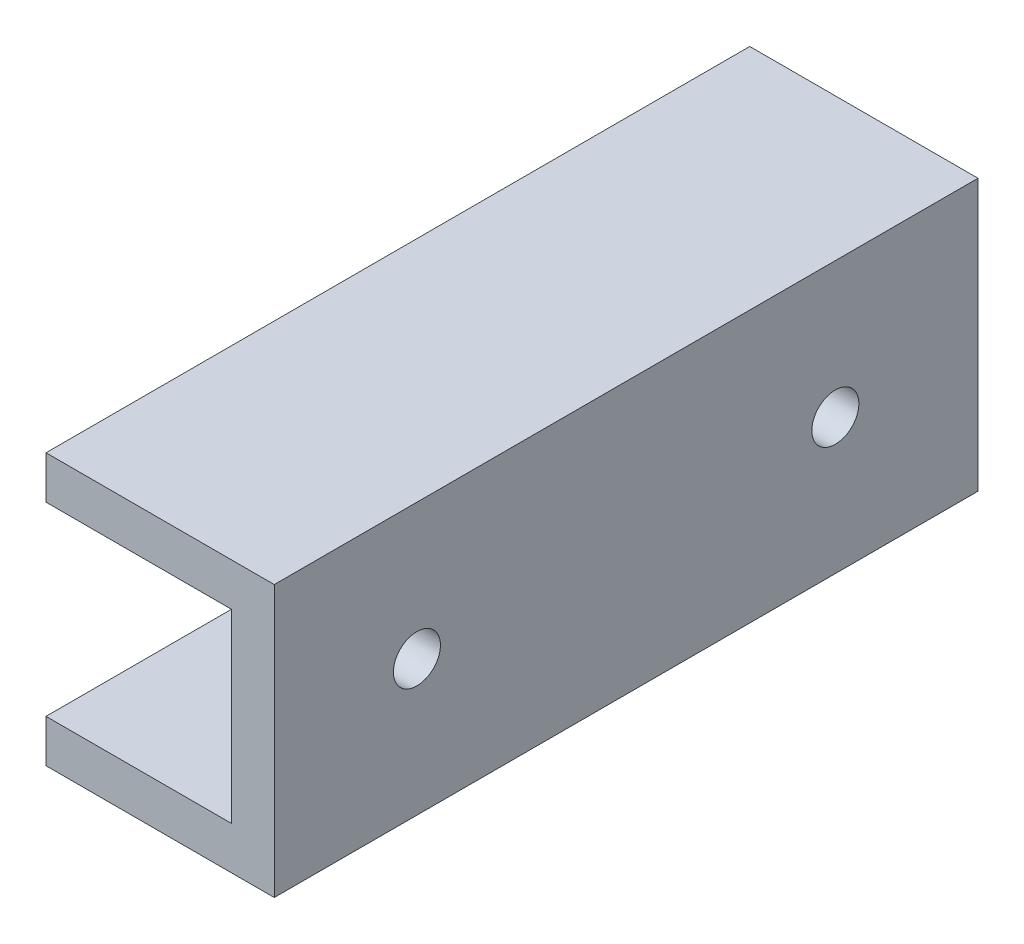
from build123d import *

# Parameters (mm, degrees)
SKETCH_1_W          = 19
SKETCH_1_H          = 19
SKETCH_1_W_2        = 13
SKETCH_1_H_2        = 13
EXTRUDE_1_DEPTH     = 49.33
SKETCH_2_R          = 1.65
CUT_EXTRUDE_1_DEPTH = 30
SKETCH_3_W          = 116.915177823
SKETCH_3_H          = 46.219516436
CUT_EXTRUDE_2_DEPTH = 3


with BuildPart() as part:
    # 草图1 → Extrude 1 (new body)
    with BuildSketch(Plane.XY):
        with Locations((6.5, 6.5)):
            Rectangle(SKETCH_1_W, SKETCH_1_H)
        with Locations((6.5, 6.5)):
            Rectangle(SKETCH_1_W_2, SKETCH_1_H_2, mode=Mode.SUBTRACT)
    extrude(amount=EXTRUDE_1_DEPTH)

    # 草图2 → 切除-拉伸1 (cut)
    with BuildSketch(Plane.ZY.offset(3)):
        with Locations((10, 6.5)):
            Circle(SKETCH_2_R)
        with Locations((39.33, 6.5)):
            Circle(SKETCH_2_R)
    extrude(amount=-CUT_EXTRUDE_1_DEPTH, mode=Mode.SUBTRACT)

    # 草图3 → 切除-拉伸2 (cut)
    with BuildSketch(Plane.ZY.offset(3)):
        with Locations((53.162237228, 0.202739406)):
            Rectangle(SKETCH_3_W, SKETCH_3_H)
    extrude(amount=-CUT_EXTRUDE_2_DEPTH, mode=Mode.SUBTRACT)


solid = part.part
